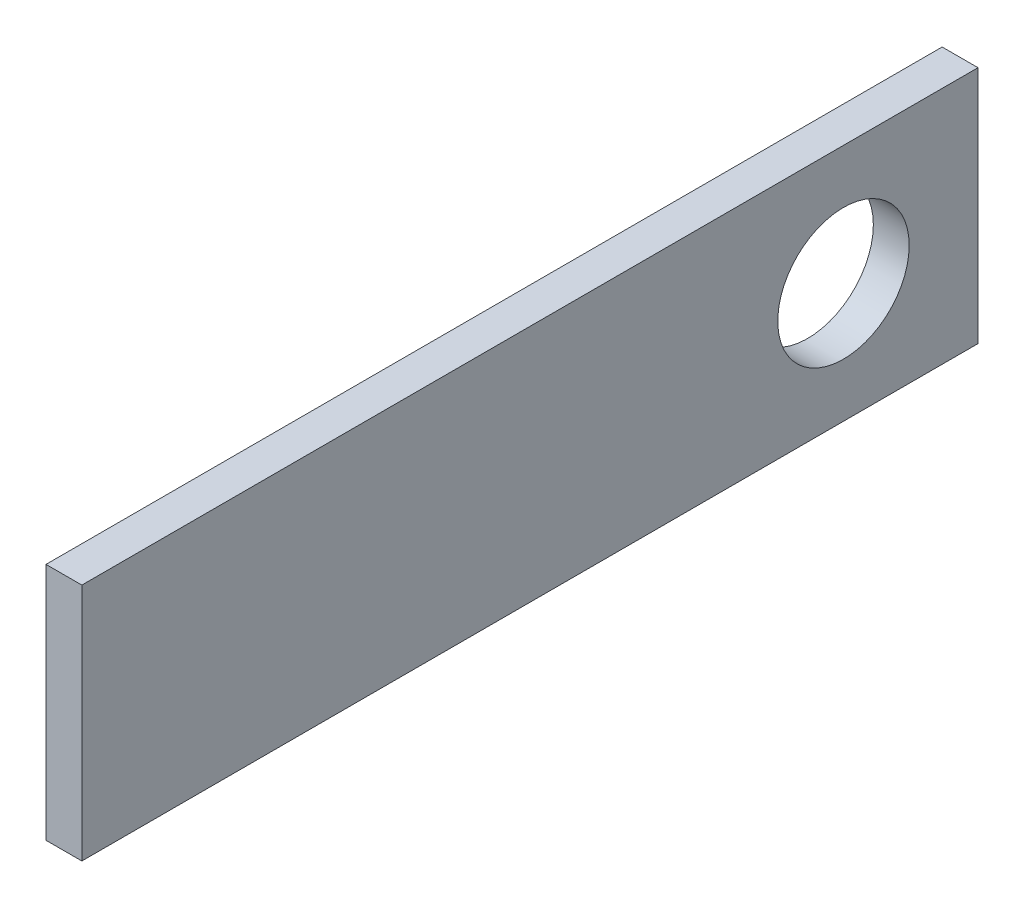
from build123d import *

# Parameters (mm, degrees)
SKETCH1_W           = 150
SKETCH1_H           = 40
SKETCH1_R           = 11
BOSS_EXTRUDE1_DEPTH = 3


with BuildPart() as part:
    # Sketch1 → Boss-Extrude1 (new, symmetric)
    with BuildSketch(Plane(origin=(0, 0, 0), x_dir=(0, 0, -1), z_dir=(1, 0, 0))):
        Rectangle(SKETCH1_W, SKETCH1_H)
        with Locations((52.481264033, 0)):
            Circle(SKETCH1_R, mode=Mode.SUBTRACT)
    extrude(amount=BOSS_EXTRUDE1_DEPTH, both=True)


solid = part.part
